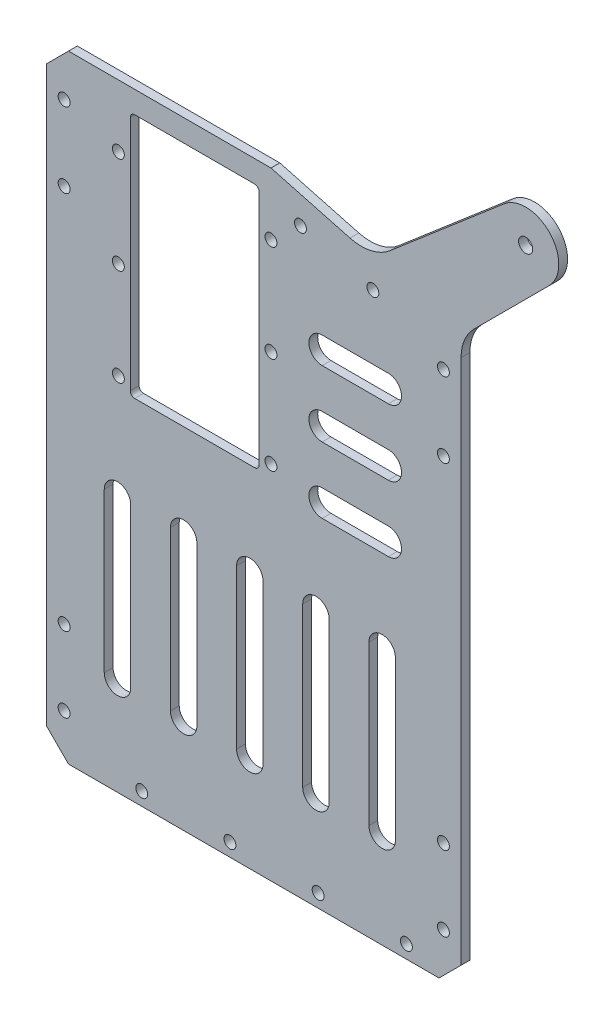
from build123d import *

# Parameters (mm, degrees)
SKETCH_1_R          = 1.35
SKETCH_1_W          = 29.2
SKETCH_1_H          = 55.7
EXTRUDE_1_DEPTH     = 2
FILLET_1_R          = 1
CUT_EXTRUDE_2_REACH = 111.266
SKETCH_2_R          = 1.35
CUT_EXTRUDE_3_REACH = 111.266
CHAMFER_1_SIZE      = 5
CUT_EXTRUDE_4_REACH = 111.266
SKETCH_4_R          = 1.35
SKETCH_5_R          = 1.6
EXTRUDE_2_DEPTH     = 2
FILLET_3_R          = 10


with BuildPart() as part:
    # 草图1 → 凸台-拉伸1 (new body)
    with BuildSketch(Plane.XY):
        Polygon((-46.1, 41.813362069), (7.9, 41.813362069), (47.9, 41.813362069), (47.9, -98.186637931), (-46.1, -98.186637931), align=None)
        with Locations((-4.5, -95.186637931)):
            Circle(SKETCH_1_R, mode=Mode.SUBTRACT)
        with Locations((-24.5, -95.186637931)):
            Circle(SKETCH_1_R, mode=Mode.SUBTRACT)
        with Locations(Location((35.5, -95.186637931, 0), (0, 0, 180))):
            Circle(SKETCH_1_R, mode=Mode.SUBTRACT)
        with Locations((-29.8, 5.713362069)):
            Circle(SKETCH_1_R, mode=Mode.SUBTRACT)
        with Locations((-29.8, -16.286637931)):
            Circle(SKETCH_1_R, mode=Mode.SUBTRACT)
        with Locations(Location((4.8, -16.286637931, 0), (0, 0, 180))):
            Circle(SKETCH_1_R, mode=Mode.SUBTRACT)
        with Locations(Location((4.8, 5.713362069, 0), (0, 0, 180))):
            Circle(SKETCH_1_R, mode=Mode.SUBTRACT)
        with Locations(Location((4.8, 27.713362069, 0), (0, 0, 180))):
            Circle(SKETCH_1_R, mode=Mode.SUBTRACT)
        with Locations((-29.8, 27.713362069)):
            Circle(SKETCH_1_R, mode=Mode.SUBTRACT)
        with Locations(Location((15.5, -95.186637931, 0), (0, 0, 180))):
            Circle(SKETCH_1_R, mode=Mode.SUBTRACT)
        with Locations((-12.5, 8.963362069)):
            Rectangle(SKETCH_1_W, SKETCH_1_H, mode=Mode.SUBTRACT)
    extrude(amount=EXTRUDE_1_DEPTH)

    # 圆角1
    fillet_1_edges = [part.edges().sort_by_distance(p)[0] for p in [
        (-27.1, 36.813362069, 1),
        (-27.1, -18.886637931, 1),
        (2.1, -18.886637931, 1),
        (2.1, 36.813362069, 1),
    ]]
    fillet(fillet_1_edges, radius=FILLET_1_R)

    # 草图2 → 切除-拉伸2 (cut, up to next)
    with BuildSketch(Plane.XY.offset(2), mode=Mode.PRIVATE) as cut_extrude_2_sk1:
        with Locations((-42.1, 31.813362069)):
            Circle(SKETCH_2_R)
    cut_extrude_2_tool1 = extrude(cut_extrude_2_sk1.sketch, amount=-CUT_EXTRUDE_2_REACH, mode=Mode.PRIVATE) & part.part
    # 草图2 → 切除-拉伸2 (cut, up to next)
    with BuildSketch(Plane.XY.offset(2), mode=Mode.PRIVATE) as cut_extrude_2_sk2:
        with Locations((-42.1, 14.813362069)):
            Circle(SKETCH_2_R)
    cut_extrude_2_tool2 = extrude(cut_extrude_2_sk2.sketch, amount=-CUT_EXTRUDE_2_REACH, mode=Mode.PRIVATE) & part.part
    # 草图2 → 切除-拉伸2 (cut, up to next)
    with BuildSketch(Plane.XY.offset(2), mode=Mode.PRIVATE) as cut_extrude_2_sk3:
        with Locations(Location((-42.1, -71.186637931, 0), (0, 0, 180))):
            Circle(SKETCH_2_R)
    cut_extrude_2_tool3 = extrude(cut_extrude_2_sk3.sketch, amount=-CUT_EXTRUDE_2_REACH, mode=Mode.PRIVATE) & part.part
    # 草图2 → 切除-拉伸2 (cut, up to next)
    with BuildSketch(Plane.XY.offset(2), mode=Mode.PRIVATE) as cut_extrude_2_sk4:
        with Locations(Location((-42.1, -88.186637931, 0), (0, 0, 180))):
            Circle(SKETCH_2_R)
    cut_extrude_2_tool4 = extrude(cut_extrude_2_sk4.sketch, amount=-CUT_EXTRUDE_2_REACH, mode=Mode.PRIVATE) & part.part
    # 草图2 → 切除-拉伸2 (cut, up to next)
    with BuildSketch(Plane.XY.offset(2), mode=Mode.PRIVATE) as cut_extrude_2_sk5:
        with Locations((43.9, -88.186637931)):
            Circle(SKETCH_2_R)
    cut_extrude_2_tool5 = extrude(cut_extrude_2_sk5.sketch, amount=-CUT_EXTRUDE_2_REACH, mode=Mode.PRIVATE) & part.part
    # 草图2 → 切除-拉伸2 (cut, up to next)
    with BuildSketch(Plane.XY.offset(2), mode=Mode.PRIVATE) as cut_extrude_2_sk6:
        with Locations((43.9, -71.186637931)):
            Circle(SKETCH_2_R)
    cut_extrude_2_tool6 = extrude(cut_extrude_2_sk6.sketch, amount=-CUT_EXTRUDE_2_REACH, mode=Mode.PRIVATE) & part.part
    # 草图2 → 切除-拉伸2 (cut, up to next)
    with BuildSketch(Plane.XY.offset(2), mode=Mode.PRIVATE) as cut_extrude_2_sk7:
        with Locations((43.9, 21.813362069)):
            Circle(SKETCH_2_R)
    cut_extrude_2_tool7 = extrude(cut_extrude_2_sk7.sketch, amount=-CUT_EXTRUDE_2_REACH, mode=Mode.PRIVATE) & part.part
    # 草图2 → 切除-拉伸2 (cut, up to next)
    with BuildSketch(Plane.XY.offset(2), mode=Mode.PRIVATE) as cut_extrude_2_sk8:
        with Locations((43.9, 4.813362069)):
            Circle(SKETCH_2_R)
    cut_extrude_2_tool8 = extrude(cut_extrude_2_sk8.sketch, amount=-CUT_EXTRUDE_2_REACH, mode=Mode.PRIVATE) & part.part
    add(cut_extrude_2_tool1.solids().sort_by_distance((-42.1, 31.813362, 2))[0], mode=Mode.SUBTRACT)
    add(cut_extrude_2_tool2.solids().sort_by_distance((-42.1, 14.813362, 2))[0], mode=Mode.SUBTRACT)
    add(cut_extrude_2_tool3.solids().sort_by_distance((-42.1, -71.186638, 2))[0], mode=Mode.SUBTRACT)
    add(cut_extrude_2_tool4.solids().sort_by_distance((-42.1, -88.186638, 2))[0], mode=Mode.SUBTRACT)
    add(cut_extrude_2_tool5.solids().sort_by_distance((43.9, -88.186638, 2))[0], mode=Mode.SUBTRACT)
    add(cut_extrude_2_tool6.solids().sort_by_distance((43.9, -71.186638, 2))[0], mode=Mode.SUBTRACT)
    add(cut_extrude_2_tool7.solids().sort_by_distance((43.9, 21.813362, 2))[0], mode=Mode.SUBTRACT)
    add(cut_extrude_2_tool8.solids().sort_by_distance((43.9, 4.813362, 2))[0], mode=Mode.SUBTRACT)

    # 草图3 → 切除-拉伸3 (cut, up to next)
    with BuildSketch(Plane.XY.offset(2), mode=Mode.PRIVATE) as cut_extrude_3_sk1:
        with BuildLine():
            Line((-3, -40.186637931), (-3, -76.186637931))
            ThreePointArc((-3, -76.186637931), (0, -79.186637931), (3, -76.186637931))
            Line((3, -76.186637931), (3, -40.186637931))
            ThreePointArc((3, -40.186637931), (0, -37.186637931), (-3, -40.186637931))
        make_face()
    cut_extrude_3_tool1 = extrude(cut_extrude_3_sk1.sketch, amount=-CUT_EXTRUDE_3_REACH, mode=Mode.PRIVATE) & part.part
    # 草图3 → 切除-拉伸3 (cut, up to next)
    with BuildSketch(Plane.XY.offset(2), mode=Mode.PRIVATE) as cut_extrude_3_sk2:
        with BuildLine():
            Line((12, -40.186637931), (12, -76.186637931))
            ThreePointArc((12, -76.186637931), (15, -79.186637931), (18, -76.186637931))
            Line((18, -76.186637931), (18, -40.186637931))
            ThreePointArc((18, -40.186637931), (15, -37.186637931), (12, -40.186637931))
        make_face()
    cut_extrude_3_tool2 = extrude(cut_extrude_3_sk2.sketch, amount=-CUT_EXTRUDE_3_REACH, mode=Mode.PRIVATE) & part.part
    # 草图3 → 切除-拉伸3 (cut, up to next)
    with BuildSketch(Plane.XY.offset(2), mode=Mode.PRIVATE) as cut_extrude_3_sk3:
        with BuildLine():
            Line((27, -40.186637931), (27, -76.186637931))
            ThreePointArc((27, -76.186637931), (30, -79.186637931), (33, -76.186637931))
            Line((33, -76.186637931), (33, -40.186637931))
            ThreePointArc((33, -40.186637931), (30, -37.186637931), (27, -40.186637931))
        make_face()
    cut_extrude_3_tool3 = extrude(cut_extrude_3_sk3.sketch, amount=-CUT_EXTRUDE_3_REACH, mode=Mode.PRIVATE) & part.part
    # 草图3 → 切除-拉伸3 (cut, up to next)
    with BuildSketch(Plane.XY.offset(2), mode=Mode.PRIVATE) as cut_extrude_3_sk4:
        with BuildLine():
            Line((-18, -40.186637931), (-18, -76.186637931))
            ThreePointArc((-18, -76.186637931), (-15, -79.186637931), (-12, -76.186637931))
            Line((-12, -76.186637931), (-12, -40.186637931))
            ThreePointArc((-12, -40.186637931), (-15, -37.186637931), (-18, -40.186637931))
        make_face()
    cut_extrude_3_tool4 = extrude(cut_extrude_3_sk4.sketch, amount=-CUT_EXTRUDE_3_REACH, mode=Mode.PRIVATE) & part.part
    # 草图3 → 切除-拉伸3 (cut, up to next)
    with BuildSketch(Plane.XY.offset(2), mode=Mode.PRIVATE) as cut_extrude_3_sk5:
        with BuildLine():
            Line((-33, -40.186637931), (-33, -76.186637931))
            ThreePointArc((-33, -76.186637931), (-30, -79.186637931), (-27, -76.186637931))
            Line((-27, -76.186637931), (-27, -40.186637931))
            ThreePointArc((-27, -40.186637931), (-30, -37.186637931), (-33, -40.186637931))
        make_face()
    cut_extrude_3_tool5 = extrude(cut_extrude_3_sk5.sketch, amount=-CUT_EXTRUDE_3_REACH, mode=Mode.PRIVATE) & part.part
    # 草图3 → 切除-拉伸3 (cut, up to next)
    with BuildSketch(Plane.XY.offset(2), mode=Mode.PRIVATE) as cut_extrude_3_sk6:
        with BuildLine():
            Line((16.4, -15.186637931), (31.4, -15.186637931))
            ThreePointArc((31.4, -15.186637931), (34.4, -18.186637931), (31.4, -21.186637931))
            Line((31.4, -21.186637931), (16.4, -21.186637931))
            ThreePointArc((16.4, -21.186637931), (13.4, -18.186637931), (16.4, -15.186637931))
        make_face()
    cut_extrude_3_tool6 = extrude(cut_extrude_3_sk6.sketch, amount=-CUT_EXTRUDE_3_REACH, mode=Mode.PRIVATE) & part.part
    # 草图3 → 切除-拉伸3 (cut, up to next)
    with BuildSketch(Plane.XY.offset(2), mode=Mode.PRIVATE) as cut_extrude_3_sk7:
        with BuildLine():
            Line((16.4, -0.186637931), (31.4, -0.186637931))
            ThreePointArc((31.4, -0.186637931), (34.4, -3.186637931), (31.4, -6.186637931))
            Line((31.4, -6.186637931), (16.4, -6.186637931))
            ThreePointArc((16.4, -6.186637931), (13.4, -3.186637931), (16.4, -0.186637931))
        make_face()
    cut_extrude_3_tool7 = extrude(cut_extrude_3_sk7.sketch, amount=-CUT_EXTRUDE_3_REACH, mode=Mode.PRIVATE) & part.part
    # 草图3 → 切除-拉伸3 (cut, up to next)
    with BuildSketch(Plane.XY.offset(2), mode=Mode.PRIVATE) as cut_extrude_3_sk8:
        with BuildLine():
            Line((16.4, 14.813362069), (31.4, 14.813362069))
            ThreePointArc((31.4, 14.813362069), (34.4, 11.813362069), (31.4, 8.813362069))
            Line((31.4, 8.813362069), (16.4, 8.813362069))
            ThreePointArc((16.4, 8.813362069), (13.4, 11.813362069), (16.4, 14.813362069))
        make_face()
    cut_extrude_3_tool8 = extrude(cut_extrude_3_sk8.sketch, amount=-CUT_EXTRUDE_3_REACH, mode=Mode.PRIVATE) & part.part
    add(cut_extrude_3_tool1.solids().sort_by_distance((0, -58.186638, 2))[0], mode=Mode.SUBTRACT)
    add(cut_extrude_3_tool2.solids().sort_by_distance((15, -58.186638, 2))[0], mode=Mode.SUBTRACT)
    add(cut_extrude_3_tool3.solids().sort_by_distance((30, -58.186638, 2))[0], mode=Mode.SUBTRACT)
    add(cut_extrude_3_tool4.solids().sort_by_distance((-15, -58.186638, 2))[0], mode=Mode.SUBTRACT)
    add(cut_extrude_3_tool5.solids().sort_by_distance((-30, -58.186638, 2))[0], mode=Mode.SUBTRACT)
    add(cut_extrude_3_tool6.solids().sort_by_distance((23.9, -18.186638, 2))[0], mode=Mode.SUBTRACT)
    add(cut_extrude_3_tool7.solids().sort_by_distance((23.9, -3.186638, 2))[0], mode=Mode.SUBTRACT)
    add(cut_extrude_3_tool8.solids().sort_by_distance((23.9, 11.813362, 2))[0], mode=Mode.SUBTRACT)

    # 倒角1
    chamfer_1_edges = [part.edges().sort_by_distance(p)[0] for p in [
        (-46.1, -98.186637931, 1),
        (-46.1, 41.813362069, 1),
        (47.9, -98.186637931, 1),
    ]]
    chamfer(chamfer_1_edges, length=CHAMFER_1_SIZE)

    # 草图4 → 切除-拉伸4 (cut, up to next)
    with BuildSketch(Plane.XY.offset(2), mode=Mode.PRIVATE) as cut_extrude_4_sk1:
        with Locations((11.479260953, 33.813362069)):
            Circle(SKETCH_4_R)
    cut_extrude_4_tool1 = extrude(cut_extrude_4_sk1.sketch, amount=-CUT_EXTRUDE_4_REACH, mode=Mode.PRIVATE) & part.part
    # 草图4 → 切除-拉伸4 (cut, up to next)
    with BuildSketch(Plane.XY.offset(2), mode=Mode.PRIVATE) as cut_extrude_4_sk2:
        with Locations((27.9, 29.413438302)):
            Circle(SKETCH_4_R)
    cut_extrude_4_tool2 = extrude(cut_extrude_4_sk2.sketch, amount=-CUT_EXTRUDE_4_REACH, mode=Mode.PRIVATE) & part.part
    # 草图4 → 切除-拉伸4 (cut, up to next)
    with BuildSketch(Plane.XY.offset(2), mode=Mode.PRIVATE) as cut_extrude_4_sk3:
        Polygon((3.000756209, 42.296827651), (53.432967786, 28.783557286), (46.405100875, 52.816513179), align=None)
    cut_extrude_4_tool3 = extrude(cut_extrude_4_sk3.sketch, amount=-CUT_EXTRUDE_4_REACH, mode=Mode.PRIVATE) & part.part
    add(cut_extrude_4_tool1.solids().sort_by_distance((11.479261, 33.813362, 2))[0], mode=Mode.SUBTRACT)
    add(cut_extrude_4_tool2.solids().sort_by_distance((27.9, 29.413438, 2))[0], mode=Mode.SUBTRACT)
    add(cut_extrude_4_tool3.solids().sort_by_distance((34.279608, 41.298966, 2))[0], mode=Mode.SUBTRACT)

    # 草图5 → 凸台-拉伸2 (add)
    with BuildSketch(Plane.XY.offset(2)):
        with BuildLine():
            Line((47.9, 30.266111536), (67.851828366, 50.217939902))
            ThreePointArc((67.851828366, 50.217939902), (68.053357953, 60.615045013), (57.67187216, 61.219331022))
            Line((57.67187216, 61.219331022), (27.798319678, 35.652340545))
            Line((27.798319678, 35.652340545), (25.855389408, 33.004755671))
            Line((25.855389408, 33.004755671), (41.831287437, 29.328293781))
            Line((41.831287437, 29.328293781), (47.9, 30.266111536))
        make_face()
        with Locations((62.548527507, 55.521240761)):
            Circle(SKETCH_5_R, mode=Mode.SUBTRACT)
    extrude(amount=-EXTRUDE_2_DEPTH)

    # 圆角3
    fillet_3_edges = [part.edges().sort_by_distance(p)[0] for p in [
        (47.9, 30.266111536, 1),
        (27.798319678, 35.652340545, 1),
    ]]
    fillet(fillet_3_edges, radius=FILLET_3_R)


solid = part.part
